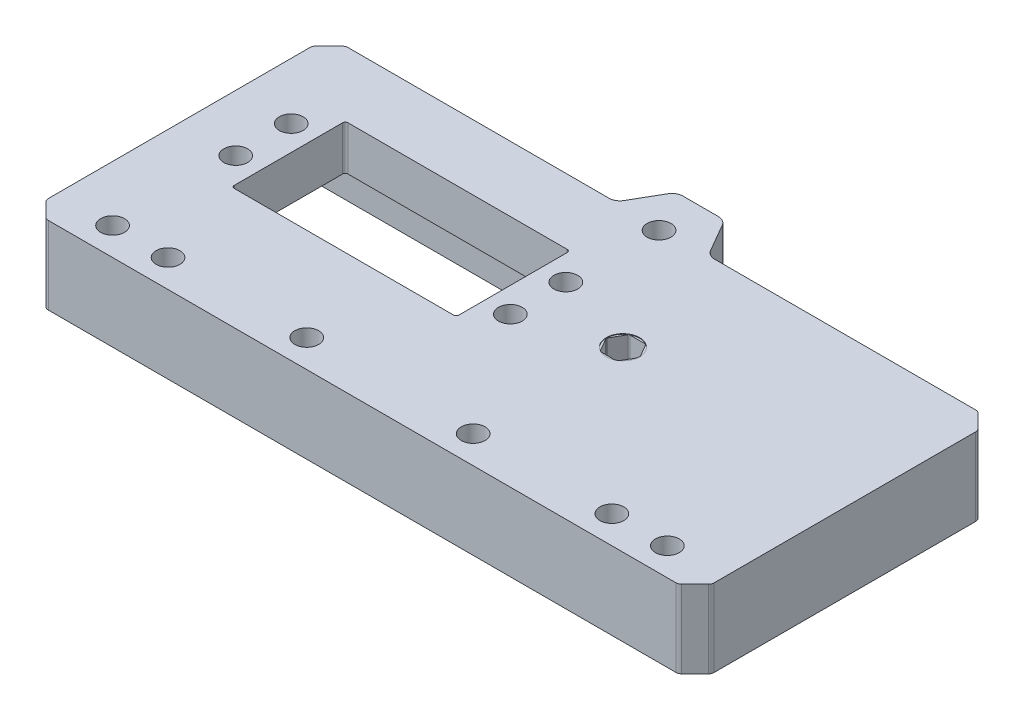
from build123d import *

# Parameters (mm, degrees)
SKETCH_1_W          = 120
SKETCH_1_H          = 44
SKETCH_1_R          = 2.15
EXTRUDE_1_DEPTH     = 8
SKETCH_2_R          = 3
CUT_EXTRUDE_1_DEPTH = 0.1
MOVE_FACE_1_BY      = 10
EXTRUDE_START       = 6
SKETCH_3_W          = 120
SKETCH_3_H          = 54
SKETCH_3_W_2        = 58
SKETCH_3_H_2        = 22
EXTRUDE_2_DEPTH     = 6
SKETCH_4_R          = 2.15
CUT_EXTRUDE_2_DEPTH = 92.942930669
CUT_EXTRUDE_3_DEPTH = 8
FILLET_1_R          = 2
FILLET_2_R          = 2
FILLET_4_R          = 1
CHAMFER_1_SIZE      = 3
FILLET_5_R          = 1
SKETCH_6_R          = 2.15
EXTRUDE_3_DEPTH     = 14
SKETCH_6_3_R        = 2.15
CUT_EXTRUDE_6_DEPTH = 92.942930669
FILLET_6_R          = 2
CHAMFER_2_SIZE      = 1
SKETCH1_R           = 5.281314446
BOSS_EXTRUDE1_DEPTH = 4
SKETCH_7_R          = 2.15
CUT_EXTRUDE_7_DEPTH = 92.942930669


with BuildPart() as part:
    # 草图1 → 凸台-拉伸1 (new body)
    with BuildSketch(Plane(origin=(0, 0, 0), x_dir=(1, 0, 0), z_dir=(0, 1, 0))):
        with Locations((25.05, 0)):
            Rectangle(SKETCH_1_W, SKETCH_1_H)
        with Locations(Location((-24.75, 5, 0), (0, 0, 270))):
            Circle(SKETCH_1_R, mode=Mode.SUBTRACT)
        with Locations(Location((-24.75, -5, 0), (0, 0, 270))):
            Circle(SKETCH_1_R, mode=Mode.SUBTRACT)
        with Locations(Location((24.75, -5, 0), (0, 0, 270))):
            Circle(SKETCH_1_R, mode=Mode.SUBTRACT)
        with Locations(Location((24.75, 5, 0), (0, 0, 270))):
            Circle(SKETCH_1_R, mode=Mode.SUBTRACT)
        with BuildLine():
            Line((19.75, -10.25), (-19.75, -10.25))
            ThreePointArc((-19.75, -10.25), (-20.103553391, -10.103553391), (-20.25, -9.75))
            Line((-20.25, -9.75), (-20.25, 9.75))
            ThreePointArc((-20.25, 9.75), (-20.103553391, 10.103553391), (-19.75, 10.25))
            Line((-19.75, 10.25), (19.75, 10.25))
            ThreePointArc((19.75, 10.25), (20.103553391, 10.103553391), (20.25, 9.75))
            Line((20.25, 9.75), (20.25, -9.75))
            ThreePointArc((20.25, -9.75), (20.103553391, -10.103553391), (19.75, -10.25))
        make_face(mode=Mode.SUBTRACT)
        with BuildLine():
            Line((42.994486373, 0.15), (41.652146997, 2.475))
            ThreePointArc((41.652146997, 2.475), (41.542339376, 2.584807621), (41.392339376, 2.625))
            Line((41.392339376, 2.625), (38.707660624, 2.625))
            ThreePointArc((38.707660624, 2.625), (38.557660624, 2.584807621), (38.447853003, 2.475))
            Line((38.447853003, 2.475), (37.105513627, 0.15))
            ThreePointArc((37.105513627, 0.15), (37.065321248, 0), (37.105513627, -0.15))
            Line((37.105513627, -0.15), (38.447853003, -2.475))
            ThreePointArc((38.447853003, -2.475), (38.557660624, -2.584807621), (38.707660624, -2.625))
            Line((38.707660624, -2.625), (41.392339376, -2.625))
            ThreePointArc((41.392339376, -2.625), (41.542339376, -2.584807621), (41.652146997, -2.475))
            Line((41.652146997, -2.475), (42.994486373, -0.15))
            ThreePointArc((42.994486373, -0.15), (43.034678752, 0), (42.994486373, 0.15))
        make_face(mode=Mode.SUBTRACT)
    extrude(amount=EXTRUDE_1_DEPTH)

    # 草图2 → 切除-拉伸1 (cut)
    with BuildSketch(Plane(origin=(0, 8, 0), x_dir=(1, 0, 0), z_dir=(0, 1, 0))):
        with Locations(Location((40.05, 0, 0), (0, 0, 270))):
            Circle(SKETCH_2_R)
    extrude(amount=-CUT_EXTRUDE_1_DEPTH, mode=Mode.SUBTRACT)

    # Move Face 1: a face moved outward by 10.0
    extrude(part.faces().sort_by_distance((25.05, 4, 22))[0], amount=MOVE_FACE_1_BY, dir=(0, 0, 1))

    # 草图3 → 凸台-拉伸2 (add)
    with BuildSketch(Plane.XZ.offset(EXTRUDE_START)):
        with Locations((25.05, 5)):
            Rectangle(SKETCH_3_W, SKETCH_3_H)
        Rectangle(SKETCH_3_W_2, SKETCH_3_H_2, mode=Mode.SUBTRACT)
        with BuildLine():
            Line((41.652146997, 2.475), (42.994486373, 0.15))
            ThreePointArc((42.994486373, 0.15), (43.034678752, 0), (42.994486373, -0.15))
            Line((42.994486373, -0.15), (41.652146997, -2.475))
            ThreePointArc((41.652146997, -2.475), (41.542339376, -2.584807621), (41.392339376, -2.625))
            Line((41.392339376, -2.625), (38.707660624, -2.625))
            ThreePointArc((38.707660624, -2.625), (38.557660624, -2.584807621), (38.447853003, -2.475))
            Line((38.447853003, -2.475), (37.105513627, -0.15))
            ThreePointArc((37.105513627, -0.15), (37.065321248, 0), (37.105513627, 0.15))
            Line((37.105513627, 0.15), (38.447853003, 2.475))
            ThreePointArc((38.447853003, 2.475), (38.557660624, 2.584807621), (38.707660624, 2.625))
            Line((38.707660624, 2.625), (41.392339376, 2.625))
            ThreePointArc((41.392339376, 2.625), (41.542339376, 2.584807621), (41.652146997, 2.475))
        make_face(mode=Mode.SUBTRACT)
    extrude(amount=-EXTRUDE_2_DEPTH)

    # 草图4 → 切除-拉伸2 (cut, through all)
    with BuildSketch(Plane.XZ.offset(6)):
        with Locations(Location((-24.95, 27, 0), (0, 0, 270))):
            Circle(SKETCH_4_R)
        with Locations(Location((-14.95, 27, 0), (0, 0, 270))):
            Circle(SKETCH_4_R)
        with Locations(Location((65.05, 27, 0), (0, 0, 90))):
            Circle(SKETCH_4_R)
        with Locations(Location((75.05, 27, 0), (0, 0, 90))):
            Circle(SKETCH_4_R)
    extrude(amount=-CUT_EXTRUDE_2_DEPTH, mode=Mode.SUBTRACT)

    # 草图5 → 切除-拉伸3 (cut)
    with BuildSketch(Plane.XZ.offset(6)):
        with BuildLine():
            Line((59.05, 21), (-8.95, 21))
            Line((-8.95, 21), (-26.95, 21))
            Line((-26.95, 21), (-26.95, 16))
            Line((-26.95, 16), (33, 16))
            Line((33, 16), (33, 5.59441686))
            ThreePointArc((33, 5.59441686), (43.012262649, 8.498529285), (49.05, 0))
            ThreePointArc((49.05, 0), (43.012262649, -8.498529285), (33, -5.59441686))
            Line((33, -5.59441686), (33, -14))
            Line((33, -14), (77.05, -14))
            Line((77.05, -14), (77.05, 21))
            Line((77.05, 21), (59.05, 21))
        make_face()
    extrude(amount=-CUT_EXTRUDE_3_DEPTH, mode=Mode.SUBTRACT)

    # 圆角1
    fillet_1_edges = [part.edges().sort_by_distance(p)[0] for p in [
        (33, -2, 5.59441686),
        (33, -2, 16),
        (-26.95, -2, 16),
        (-26.95, -2, 21),
        (77.05, -2, 21),
        (77.05, -2, -14),
        (33, -2, -14),
    ]]
    fillet(fillet_1_edges, radius=FILLET_1_R)

    # 圆角2
    fillet_2_edges = [part.edges().sort_by_distance(p)[0] for p in [
        (33, -2, -5.59441686),
    ]]
    fillet(fillet_2_edges, radius=FILLET_2_R)

    # 圆角4
    fillet_4_edges = [part.edges().sort_by_distance(p)[0] for p in [
        (-29, -3, -11),
        (29, -3, -11),
        (29, -3, 11),
        (-29, -3, 11),
    ]]
    fillet(fillet_4_edges, radius=FILLET_4_R)

    # 倒角1
    chamfer_1_edges = [part.edges().sort_by_distance(p)[0] for p in [
        (-34.95, 1, -22),
        (85.05, 1, -22),
        (85.05, 1, 32),
        (-34.95, 1, 32),
    ]]
    chamfer(chamfer_1_edges, length=CHAMFER_1_SIZE)

    # 圆角5
    fillet_5_edges = [part.edges().sort_by_distance(p)[0] for p in [
        (85.05, 1, -19),
        (85.05, 1, 29),
        (-31.95, 1, 32),
        (82.05, 1, 32),
        (-31.95, 1, -22),
        (82.05, 1, -22),
        (-34.95, 1, -19),
        (-34.95, 1, 29),
    ]]
    fillet(fillet_5_edges, radius=FILLET_5_R)

    # 草图6 → 凸台-拉伸3 (add)
    with BuildSketch(Plane.XZ.offset(6)):
        Polygon((33.710254038, -21.5), (29.380127019, -14), (20.719872981, -14), (16.389745962, -21.5), (20.719872981, -29), (29.380127019, -29), align=None)
        with Locations((25.05, -21.5)):
            Circle(SKETCH_6_R, mode=Mode.SUBTRACT)
    extrude(amount=-EXTRUDE_3_DEPTH)

    # 草图6<3> → 切除-拉伸6 (cut, through all)
    with BuildSketch(Plane.XZ.offset(6)):
        with Locations(Location((25.05, -21.5, 0), (0, 0, 270))):
            Circle(SKETCH_6_3_R)
    extrude(amount=-CUT_EXTRUDE_6_DEPTH, mode=Mode.SUBTRACT)

    # 圆角6
    fillet_6_edges = [part.edges().sort_by_distance(p)[0] for p in [
        (16.678421097, 1, -22),
        (33.421578903, 1, -22),
        (20.719872981, 1, -29),
        (29.380127019, 1, -29),
    ]]
    fillet(fillet_6_edges, radius=FILLET_6_R)

    # 倒角2
    chamfer_2_edges = [part.edges().sort_by_distance(p)[0] for p in [
        (33, -6, 11.886141115),
        (33, 2, 11.886141115),
        (33, 2, -10.886141115),
        (55.025, 2, -14),
        (77.05, 2, 3.5),
        (25.05, 2, 21),
        (-26.95, 2, 18.5),
        (3.025, 2, 16),
        (33.585786438, 2, -13.414213562),
        (-26.364213562, 2, 20.414213562),
        (76.464213562, 2, -13.414213562),
        (76.464213562, 2, 20.414213562),
        (-26.364213562, 2, 16.585786438),
        (33.95989511, 2, 8.06401357),
        (3.025, -6, 16),
        (-26.95, -6, 18.5),
        (25.05, -6, 21),
        (77.05, -6, 3.5),
        (55.025, -6, -14),
        (33, -6, -10.886141115),
        (32.414213562, -6, 15.414213562),
        (33.95989511, -6, 8.06401357),
        (-26.364213562, -6, 16.585786438),
        (76.464213562, -6, 20.414213562),
        (76.464213562, -6, -13.414213562),
        (-26.364213562, -6, 20.414213562),
        (33.585786438, -6, -13.414213562),
        (32.414213562, 2, 15.414213562),
        (49.05, 2, 0),
        (49.05, -6, 0),
        (33.95989511, 2, -8.06401357),
        (33.95989511, -6, -8.06401357),
        (0, -6, -11),
        (29, -6, 0),
        (0, -6, 11),
        (-29, -6, 0),
        (28.707106781, -6, -10.707106781),
        (28.707106781, -6, 10.707106781),
        (-28.707106781, -6, -10.707106781),
        (-28.707106781, -6, 10.707106781),
    ]]
    chamfer(chamfer_2_edges, length=CHAMFER_2_SIZE)

    # Sketch1 → Boss-Extrude1 (add)
    with BuildSketch(Plane.XZ.offset(6)):
        with Locations((40.074190607, 0)):
            Circle(SKETCH1_R)
    extrude(amount=-BOSS_EXTRUDE1_DEPTH)

    # 草图7 → 切除-拉伸7 (cut, through all)
    with BuildSketch(Plane.XZ.offset(6)):
        with Locations(Location((10.05, 27, 0), (0, 0, 270))):
            Circle(SKETCH_7_R)
        with Locations(Location((40.05, 27, 0), (0, 0, 90))):
            Circle(SKETCH_7_R)
    extrude(amount=-CUT_EXTRUDE_7_DEPTH, mode=Mode.SUBTRACT)


solid = part.part
